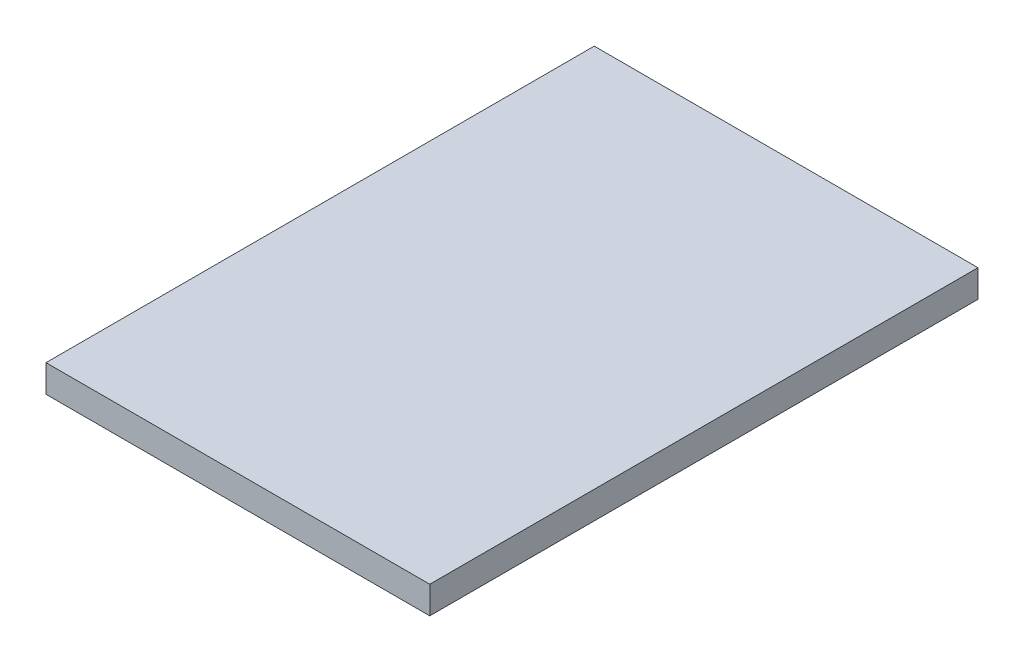
from build123d import *

# Parameters (mm, degrees)
SKETCH1_W           = 3500
SKETCH1_H           = 5000
BOSS_EXTRUDE1_DEPTH = 250


with BuildPart() as part:
    # Sketch1 → Boss-Extrude1 (new body)
    with BuildSketch(Plane(origin=(0, 0, 0), x_dir=(1, 0, 0), z_dir=(0, 1, 0))):
        with Locations((-602.901143346, -618.72909699)):
            Rectangle(SKETCH1_W, SKETCH1_H)
    extrude(amount=BOSS_EXTRUDE1_DEPTH)


solid = part.part
